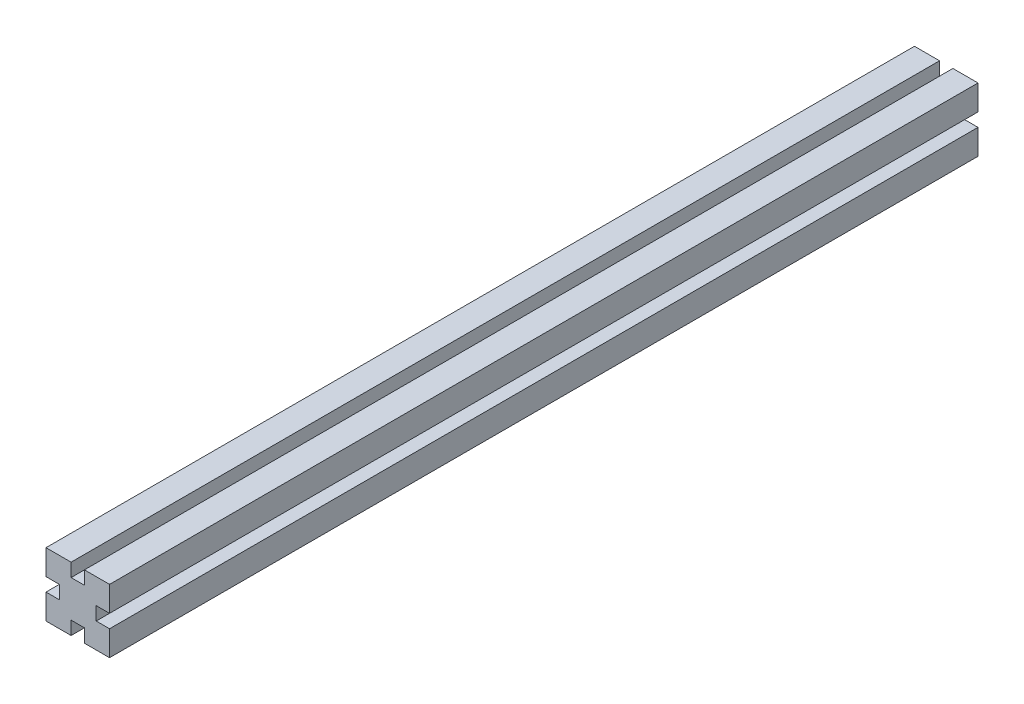
from build123d import *

# Parameters (mm, degrees)
PROFILE_DEPTH = 520.7


with BuildPart() as part:
    # Sketch1 → Profile (new body)
    with BuildSketch(Plane.XY):
        Polygon((-19.05, -19.05), (-4, -19.05), (-4, -11.05), (4, -11.05), (4, -19.05), (19.05, -19.05), (19.05, -4), (11.05, -4), (11.05, 4), (19.05, 4), (19.05, 19.05), (4, 19.05), (4, 11.05), (-4, 11.05), (-4, 19.05), (-19.05, 19.05), (-19.05, 4), (-11.05, 4), (-11.05, -4), (-19.05, -4), align=None)
    extrude(amount=PROFILE_DEPTH)


solid = part.part
